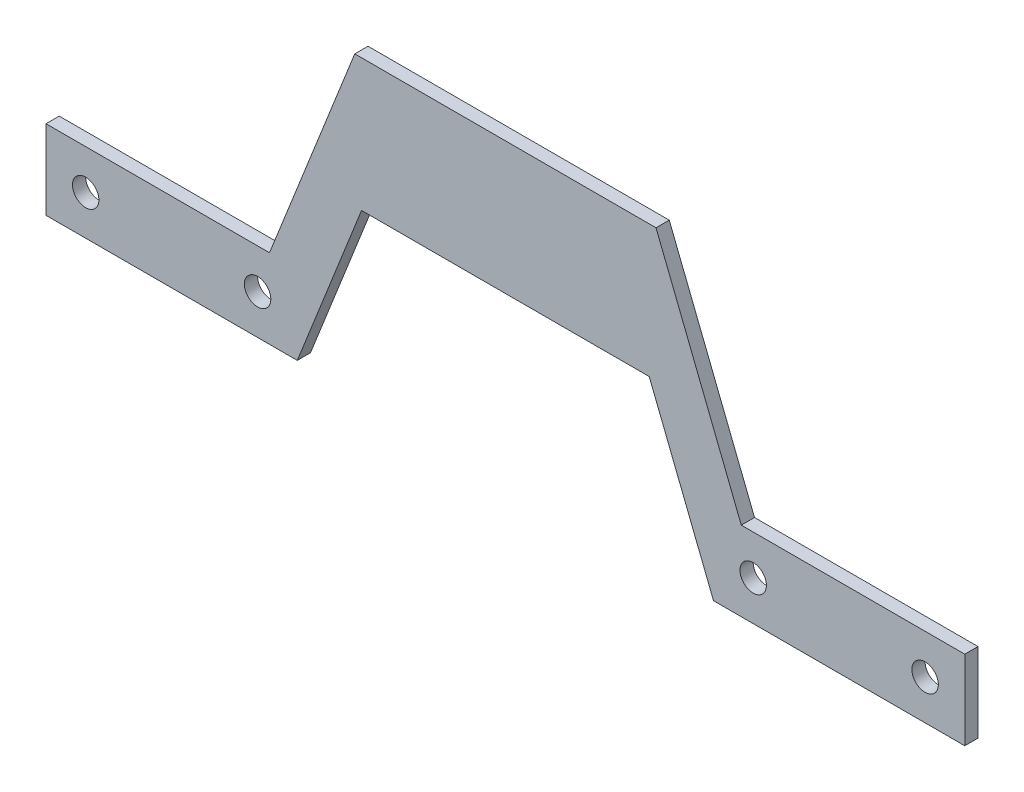
from build123d import *

# Parameters (mm, degrees)
ESBO_O1_R                = 2
RESSALTO_EXTRUS_O2_DEPTH = 2


with BuildPart() as part:
    # Esboço1 → Ressalto-extrusão2 (new body)
    with BuildSketch(Plane.XY):
        Polygon((-0.066609968, -5.044992778), (0.066609968, -5.044992778), (21.752134594, -5.044992778), (31.476547475, -29.544992778), (69.476547475, -29.544992778), (69.476547475, -17.544992778), (35.678254574, -17.544992778), (22.778523201, 14.955007222), (-22.778523201, 14.955007222), (-35.678254574, -17.544992778), (-69.476547475, -17.544992778), (-69.476547475, -29.544992778), (-31.476547475, -29.544992778), (-21.752134594, -5.044992778), align=None)
        with Locations((-63.476547475, -23.544992778)):
            Circle(ESBO_O1_R, mode=Mode.SUBTRACT)
        with Locations((-37.476547475, -23.544992778)):
            Circle(ESBO_O1_R, mode=Mode.SUBTRACT)
        with Locations((37.476547475, -23.544992778)):
            Circle(ESBO_O1_R, mode=Mode.SUBTRACT)
        with Locations((63.476547475, -23.544992778)):
            Circle(ESBO_O1_R, mode=Mode.SUBTRACT)
    extrude(amount=RESSALTO_EXTRUS_O2_DEPTH)


solid = part.part
